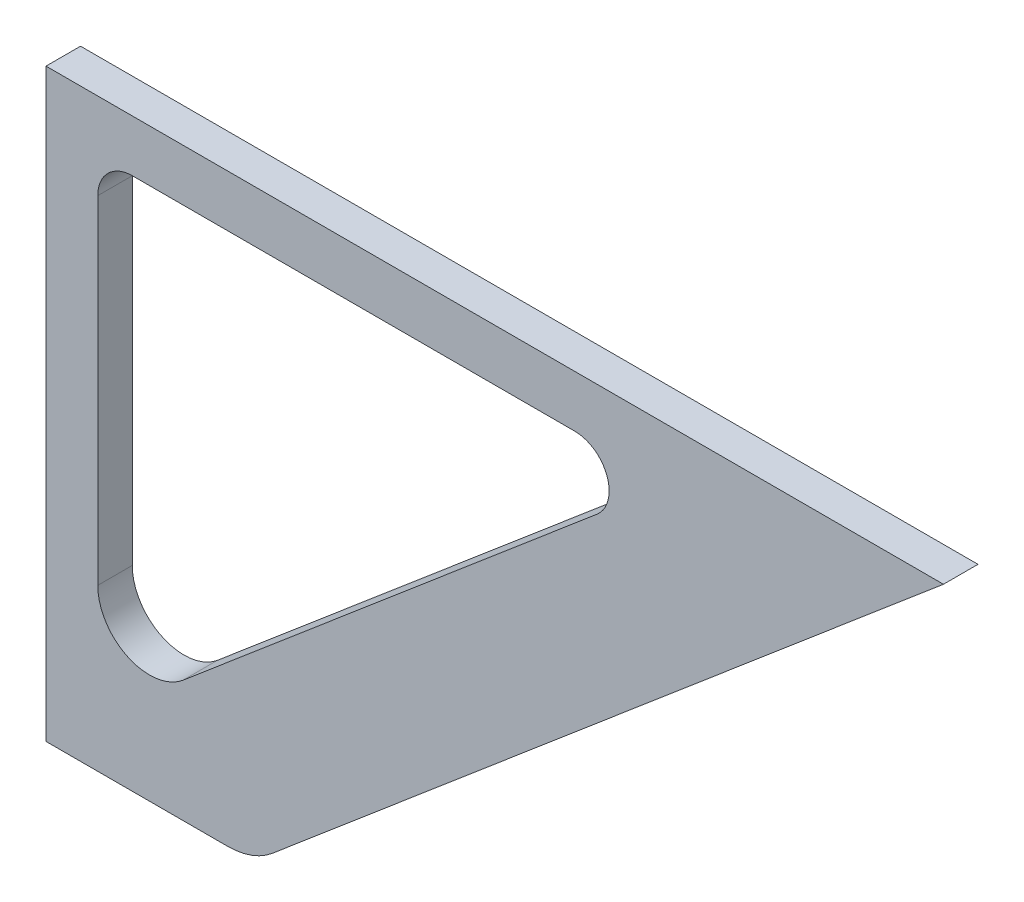
from build123d import *

# Parameters (mm, degrees)
BOSS_EXTRUDE1_DEPTH = 3.175


with BuildPart() as part:
    # Sketch1 → Boss-Extrude1 (new body)
    with BuildSketch(Plane.XY):
        with BuildLine():
            Line((0, 0), (0, -53.7972))
            Line((0, -53.7972), (16.721750646, -53.7972))
            ThreePointArc((16.721750646, -53.7972), (18.907698166, -53.40909009), (20.826436899, -52.292202659))
            Line((20.826436899, -52.292202659), (82.55, 0))
            Line((82.55, 0), (0, 0))
        make_face()
        with BuildLine():
            Line((7.9375, -4.7625), (48.622081998, -4.7625))
            ThreePointArc((48.622081998, -4.7625), (51.603027043, -6.84452624), (50.674425125, -10.36000133))
            Line((50.674425125, -10.36000133), (12.60351469, -42.61367665))
            ThreePointArc((12.60351469, -42.61367665), (7.522504052, -43.300968075), (4.7625, -38.979924656))
            Line((4.7625, -38.979924656), (4.7625, -7.9375))
            ThreePointArc((4.7625, -7.9375), (5.69243597, -5.69243597), (7.9375, -4.7625))
        make_face(mode=Mode.SUBTRACT)
    extrude(amount=BOSS_EXTRUDE1_DEPTH)


solid = part.part
